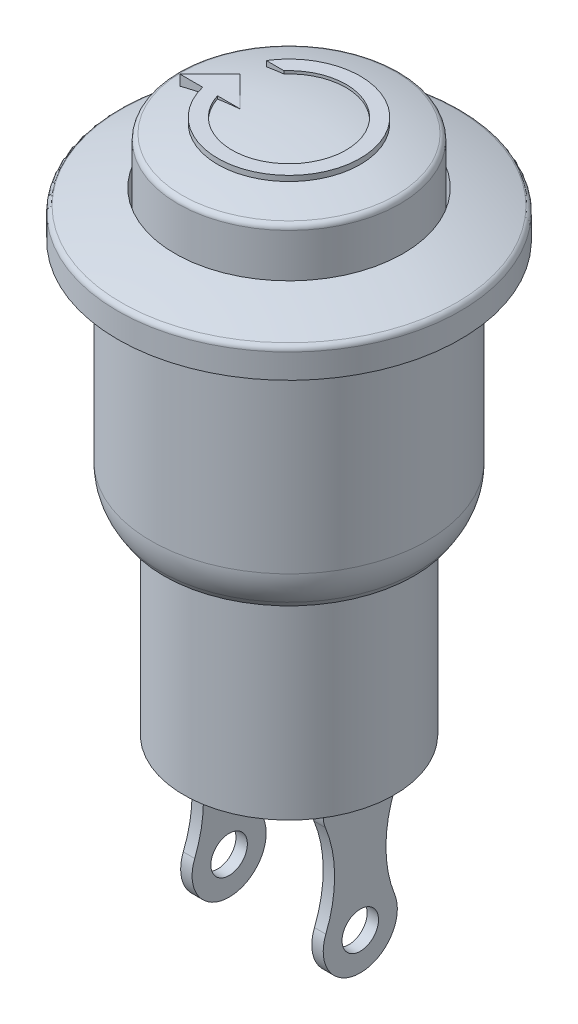
from build123d import *

# Parameters (mm, degrees)
CONG_1_R                 = 0.2
CONG_2_R                 = 0.2
CHANFREIN1_SIZE          = 0.7
CHANFREIN1_SIZE2         = 0.454585315
CONG_3_R                 = 2
ESQUISSE2_W              = 0.4
ESQUISSE2_H              = 2.6
BOSS_EXTRU_1_DEPTH       = 6
ESQUISSE3_R              = 0.64
ENL_V_MAT_EXTRU_1_DEPTH  = 6
CONG_4_R                 = 1
RESSALTO_EXTRUS_O1_DEPTH = 0.5


with BuildPart() as part:
    # Esquisse1 → Révolution1 (revolve)
    with BuildSketch(Plane.XY, mode=Mode.PRIVATE) as r_volution1_sk:
        with BuildLine():
            Line((0, 18.8), (0, 0))
            Line((0, 0), (3.69, 0))
            Line((3.69, 0), (3.69, 7))
            Line((3.69, 7), (4.84, 7))
            Line((4.84, 7), (4.84, 15))
            Line((4.84, 15), (6.01, 15))
            Line((6.01, 15), (6.01, 16))
            ThreePointArc((6.01, 16), (5.013982948, 16.330092875), (4, 16.6))
            Line((4, 16.6), (4, 15.013190638))
            Line((4, 15.013190638), (3.89, 15.013190638))
            Line((3.89, 15.013190638), (3.89, 18.2))
            ThreePointArc((3.89, 18.2), (1.968000254, 18.649118314), (0, 18.8))
        make_face()
    revolve(r_volution1_sk.sketch.rotate(Axis((0, 0, 0), (0, 1, 0)), 90), axis=Axis((0, 0, 0), (0, 1, 0)))

    # Congé1
    cong_1_edges = [part.edges().sort_by_distance(p)[0] for p in [
        (0, 18.2, 3.89),
    ]]
    fillet(cong_1_edges, radius=CONG_1_R)

    # Congé2
    cong_2_edges = [part.edges().sort_by_distance(p)[0] for p in [
        (0, 16, 6.01),
    ]]
    fillet(cong_2_edges, radius=CONG_2_R)

    # Chanfrein1
    chanfrein1_edges = [part.edges().sort_by_distance(p)[0] for p in [
        (0, 7, 4.84),
    ]]
    chanfrein1_side = [part.faces().sort_by_distance(p)[0] for p in [
        (0, 11, 4.84),
    ]]
    chamfer(chanfrein1_edges, length=CHANFREIN1_SIZE, length2=CHANFREIN1_SIZE2, reference=chanfrein1_side[0])

    # Congé3
    cong_3_edges = [part.edges().sort_by_distance(p)[0] for p in [
        (0, 7.7, 4.84),
    ]]
    fillet(cong_3_edges, radius=CONG_3_R)

    # Esquisse2 → Boss.-Extru.1 (add)
    with BuildSketch(Plane.XZ):
        with Locations((2.3, 0)):
            Rectangle(ESQUISSE2_W, ESQUISSE2_H)
        with Locations((-2.3, 0)):
            Rectangle(ESQUISSE2_W, ESQUISSE2_H)
    extrude(amount=BOSS_EXTRU_1_DEPTH)

    # Esquisse3 → Enlèv. mat.-Extru.1 (cut)
    with BuildSketch(Plane.ZY.offset(2.5)):
        with Locations((0, -4.7)):
            Circle(ESQUISSE3_R)
        with BuildLine():
            Line((-1.3, -0.8), (-4.192462756, -0.8))
            Line((-4.192462756, -0.8), (-4.192462756, -7.475627282))
            Line((-4.192462756, -7.475627282), (5.572809524, -7.57510374))
            Line((5.572809524, -7.57510374), (5.225347222, -0.8))
            Line((5.225347222, -0.8), (1.3, -0.8))
            ThreePointArc((1.3, -0.8), (0.901580438, -2.499750503), (1.207561262, -4.218548238))
            ThreePointArc((1.207561262, -4.218548238), (0, -6), (-1.207561262, -4.218548238))
            ThreePointArc((-1.207561262, -4.218548238), (-0.901580438, -2.499750503), (-1.3, -0.8))
        make_face()
    extrude(amount=-ENL_V_MAT_EXTRU_1_DEPTH, mode=Mode.SUBTRACT)

    # Congé4
    cong_4_edges = [part.edges().sort_by_distance(p)[0] for p in [
        (-2.3, -0.8, 1.3),
        (-2.3, -0.8, -1.3),
        (2.3, -0.8, -1.3),
        (2.3, -0.8, 1.3),
    ]]
    fillet(cong_4_edges, radius=CONG_4_R)

    # Esboço1 → Ressalto-extrusão1 (add, symmetric)
    with BuildSketch(Plane(origin=(0, 18.243955153, 0), x_dir=(-1, 0, 0), z_dir=(0, -1, 0))):
        with BuildLine():
            Line((1.106856798, -0.603238885), (1.906856798, -0.603238885))
            ThreePointArc((1.906856798, -0.603238885), (-1.956724443, -0.413798809), (1.499383453, 1.323574426))
            Line((1.499383453, 1.323574426), (2.120884424, 1.323574426))
            ThreePointArc((2.120884424, 1.323574426), (-2.469207481, -0.39117057), (2.42612919, -0.603238885))
            Line((2.42612919, -0.603238885), (3.22612919, -0.603238885))
            Line((3.22612919, -0.603238885), (2.166492994, 0.456397311))
            Line((2.166492994, 0.456397311), (1.106856798, -0.603238885))
        make_face()
    extrude(amount=RESSALTO_EXTRUS_O1_DEPTH, both=True)


solid = part.part
